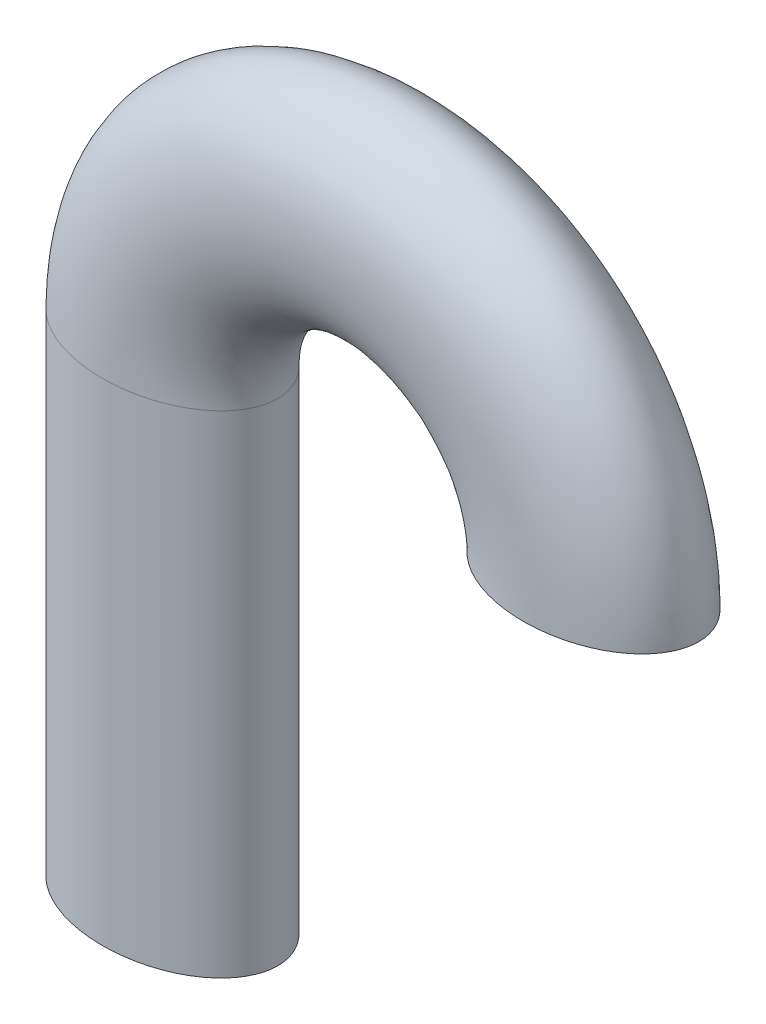
from build123d import *

# Parameters (mm, degrees)
SKETCH_2_RX = 6
SKETCH_2_RY = 4


with BuildPart() as part:
    # 扫描2: sweep along a path in 草图3
    with BuildLine(Plane.XY) as sweep_2_path:
        Line((0, 0), (0, 28))
        ThreePointArc((0, 28), (12, 40), (24, 28))
    # 草图2 → 扫描2 (sweep)
    with BuildSketch(Plane(origin=(0, 0, 0), x_dir=(1, 0, 0), z_dir=(0, 1, 0))):
        with Locations(Location((0, 0), (0, 0, 180))):
            Ellipse(SKETCH_2_RX, SKETCH_2_RY)
    sweep(path=sweep_2_path.line)


solid = part.part
